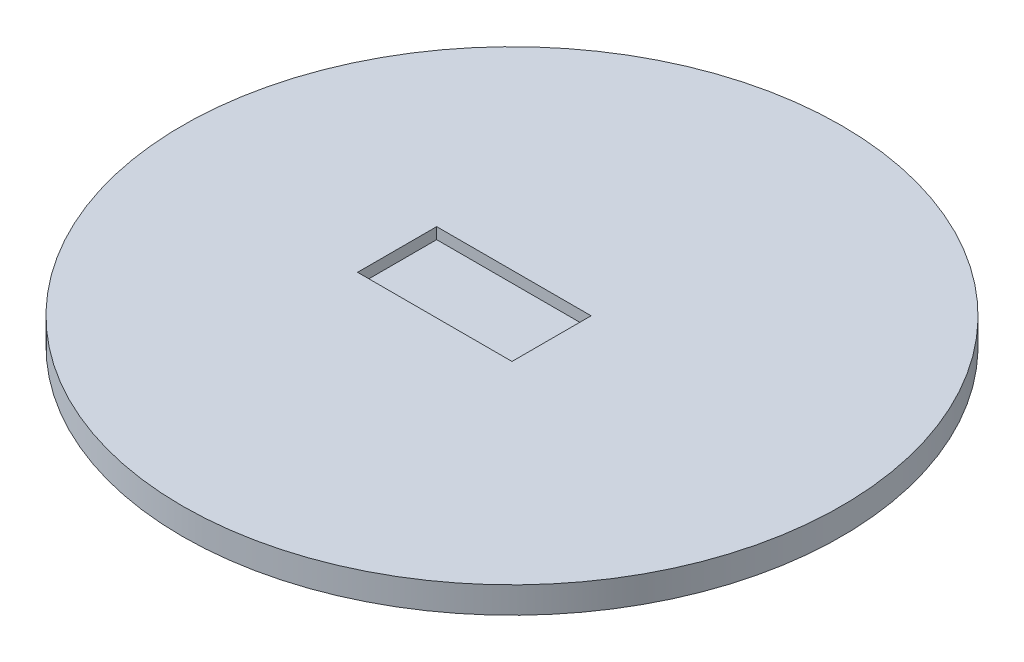
from build123d import *

# Parameters (mm, degrees)
SKETCH1_R           = 87.5
BOSS_EXTRUDE1_DEPTH = 7
SKETCH2_W           = 41
SKETCH2_H           = 21
CUT_EXTRUDE1_DEPTH  = 3


with BuildPart() as part:
    # Sketch1 → Boss-Extrude1 (new body)
    with BuildSketch(Plane(origin=(0, 0, 0), x_dir=(1, 0, 0), z_dir=(0, 1, 0))):
        with Locations(Location((0, 0, 0), (0, 0, 270))):
            Circle(SKETCH1_R)
    extrude(amount=BOSS_EXTRUDE1_DEPTH)

    # Sketch2 → Cut-Extrude1 (cut)
    with BuildSketch(Plane(origin=(0, 7, 0), x_dir=(1, 0, 0), z_dir=(0, 1, 0))):
        with Locations((-10, 0)):
            Rectangle(SKETCH2_W, SKETCH2_H)
    extrude(amount=-CUT_EXTRUDE1_DEPTH, mode=Mode.SUBTRACT)


solid = part.part
